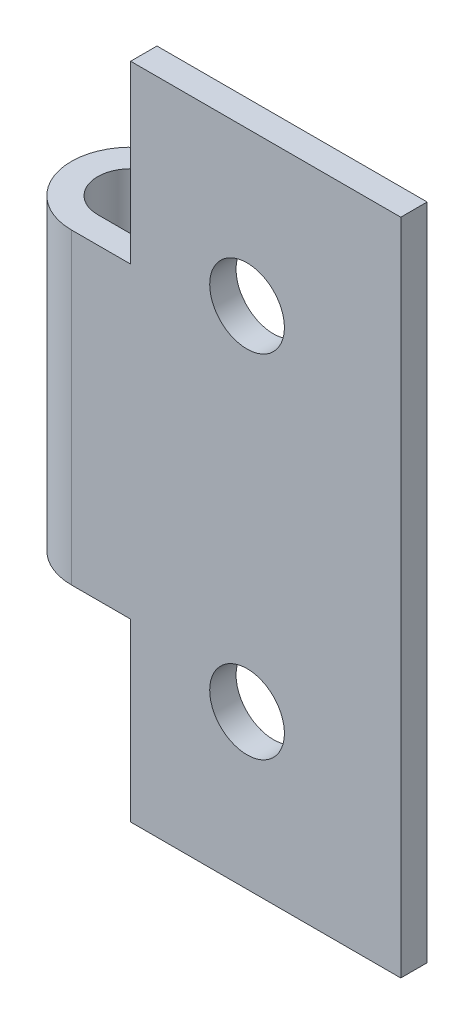
from build123d import *

# Parameters (mm, degrees)
Y_KSEKLIK_EKSTR_ZYON1_DEPTH = 30
KES_EKSTR_ZYON2_START       = -8
KES_EKSTR_ZYON2_DEPTH       = 8
IZIM4_R                     = 1.7
KES_EKSTR_ZYON3_DEPTH       = 1.2


with BuildPart() as part:
    # Çizim1 → Yükseklik-Ekstrüzyon1 (new body)
    with BuildSketch(Plane(origin=(0, 0, 0), x_dir=(1, 0, 0), z_dir=(0, 1, 0))):
        with BuildLine():
            Line((0, 0.6), (15, 0.6))
            Line((15, 0.6), (15, -0.6))
            Line((15, -0.6), (0, -0.6))
            ThreePointArc((0, -0.6), (-1.319038138, 4.455873169), (2.301841896, 0.688786378))
            Line((2.301841896, 0.688786378), (1.278801053, 1.315992432))
            ThreePointArc((1.278801053, 1.315992432), (-0.732798966, 3.408818427), (0, 0.6))
        make_face()
    extrude(amount=-Y_KSEKLIK_EKSTR_ZYON1_DEPTH)

    # Çizim3 → Kes-Ekstrüzyon2 (cut)
    with BuildSketch(Plane.XZ.offset(30).offset(KES_EKSTR_ZYON2_START)):
        with BuildLine():
            Line((1.278801053, -1.315992432), (2.301841896, -0.688786378))
            ThreePointArc((2.301841896, -0.688786378), (-1.319038138, -4.455873169), (0, 0.6))
            Line((0, 0.6), (2.7, 0.6))
            Line((2.7, 0.6), (2.7, -0.6))
            Line((2.7, -0.6), (0, -0.6))
            ThreePointArc((0, -0.6), (-0.732798966, -3.408818427), (1.278801053, -1.315992432))
        make_face()
    kes_ekstr_zyon2 = extrude(amount=KES_EKSTR_ZYON2_DEPTH, mode=Mode.SUBTRACT)

    # Çizim4 → Kes-Ekstrüzyon3 (cut)
    with BuildSketch(Plane(origin=(0, 0, -0.6), x_dir=(-1, 0, 0), z_dir=(0, 0, -1))):
        with Locations((-8, -23)):
            Circle(IZIM4_R)
        with Locations((-8, -7)):
            Circle(IZIM4_R)
    extrude(amount=-KES_EKSTR_ZYON3_DEPTH, mode=Mode.SUBTRACT)

    # Aynalama1: Kes-Ekstrüzyon2 across plane
    add(kes_ekstr_zyon2.mirror(Plane(origin=(0, -15, 0), x_dir=(0, 0, 1), z_dir=(0, -1, 0))), mode=Mode.SUBTRACT)


solid = part.part
